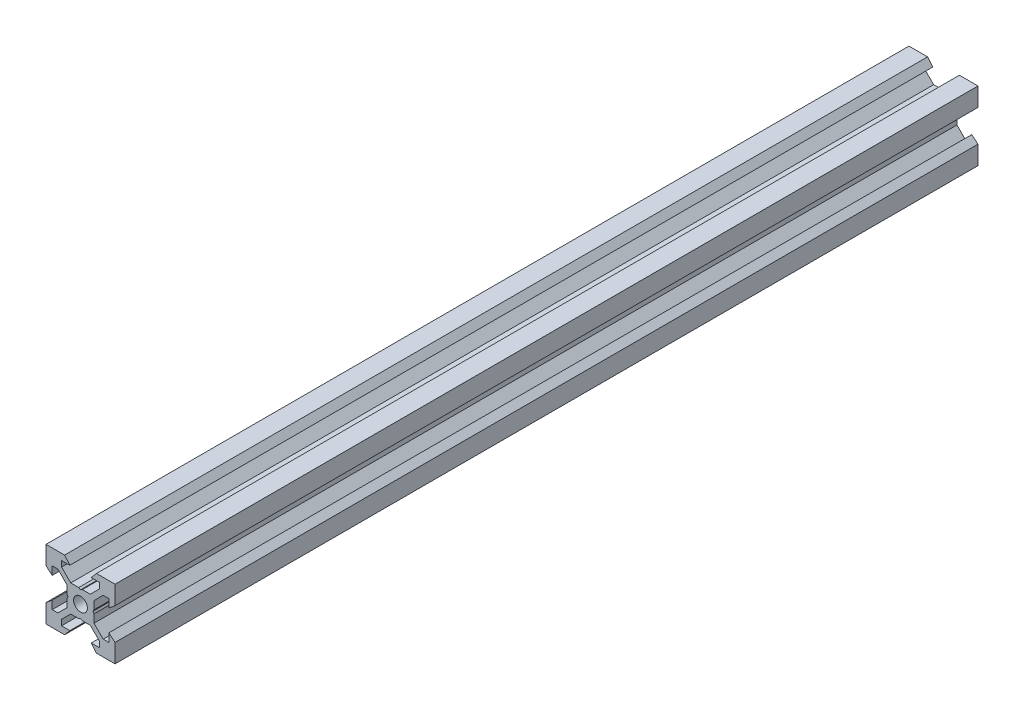
from build123d import *

# Parameters (mm, degrees)
SKETCH1_R           = 2
BOSS_EXTRUDE1_DEPTH = 125


with BuildPart() as part:
    # Sketch1 → Boss-Extrude1 (new, symmetric)
    with BuildSketch(Plane.XY):
        Polygon((10, 10), (10, 4.610379336), (8.2, 3.1), (8.2, 5.5), (6.560660172, 5.5), (3.9, 2.839339828), (3.9, 0.519615242), (3.6, 0), (3.9, -0.519615242), (3.9, -2.839339828), (6.560660172, -5.5), (8.2, -5.5), (8.2, -3.1), (10, -4.610379336), (10, -10), (4.610379336, -10), (3.1, -8.2), (5.5, -8.2), (5.5, -6.560660172), (2.839339828, -3.9), (0.519615242, -3.9), (0, -3.6), (-0.519615242, -3.9), (-2.839339828, -3.9), (-5.5, -6.560660172), (-5.5, -8.2), (-3.1, -8.2), (-4.610379336, -10), (-10, -10), (-10, -4.610379336), (-8.2, -3.1), (-8.2, -5.5), (-6.560660172, -5.5), (-3.9, -2.839339828), (-3.9, -0.519615242), (-3.6, 0), (-3.9, 0.519615242), (-3.9, 2.839339828), (-6.560660172, 5.5), (-8.2, 5.5), (-8.2, 3.1), (-10, 4.610379336), (-10, 10), (-4.610379336, 10), (-3.1, 8.2), (-5.5, 8.2), (-5.5, 6.560660172), (-2.839339828, 3.9), (-0.519615242, 3.9), (0, 3.6), (0.519615242, 3.9), (2.839339828, 3.9), (5.5, 6.560660172), (5.5, 8.2), (3.1, 8.2), (4.610379336, 10), align=None)
        Circle(SKETCH1_R, mode=Mode.SUBTRACT)
    extrude(amount=BOSS_EXTRUDE1_DEPTH, both=True)


solid = part.part
